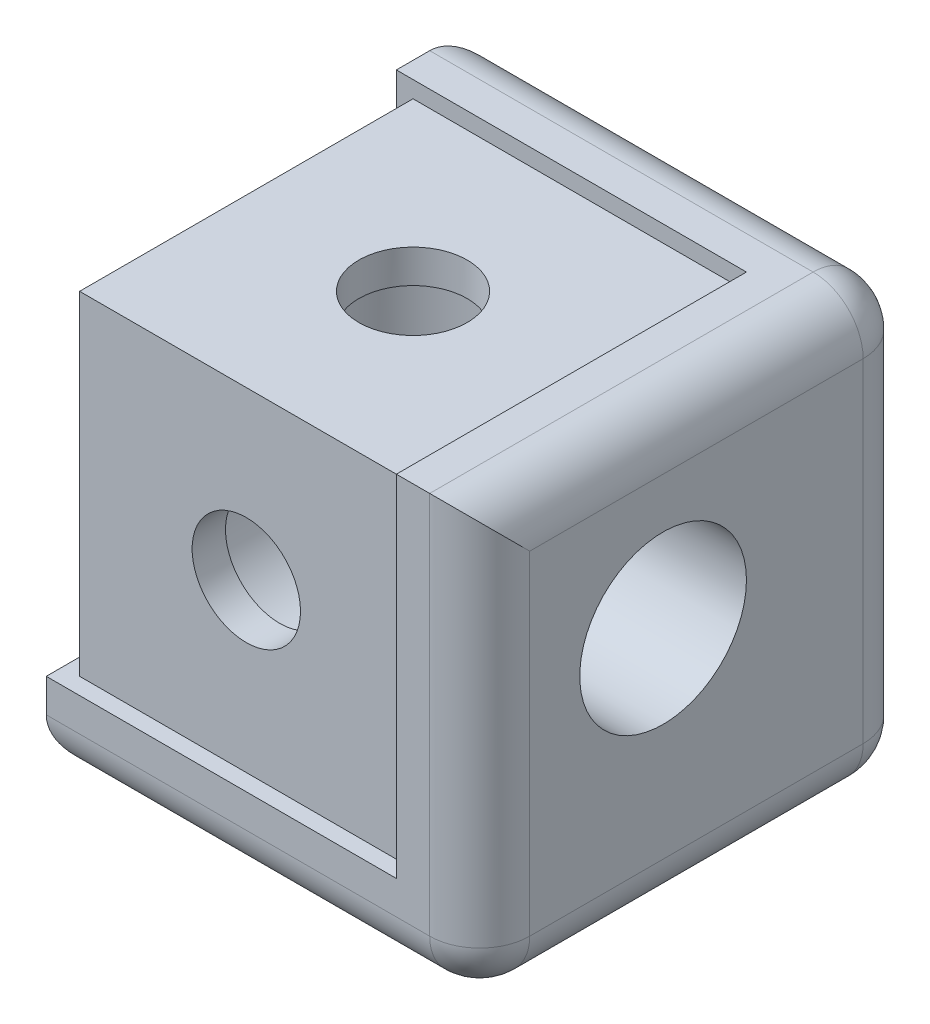
from build123d import *

# Parameters (mm, degrees)
SKETCH2_W           = 25
SKETCH2_H           = 25
BOSS_EXTRUDE1_DEPTH = 25
SKETCH3_R           = 3.25
CUT_EXTRUDE1_DEPTH  = 44.301270189
SKETCH4_R           = 3.25
CUT_EXTRUDE2_DEPTH  = 44.301270189
SKETCH5_R           = 3.25
CUT_EXTRUDE3_DEPTH  = 44.301270189
SKETCH6_R           = 5
CUT_EXTRUDE4_DEPTH  = 23
SKETCH7_R           = 5
CUT_EXTRUDE5_DEPTH  = 23
SKETCH12_R          = 5
CUT_EXTRUDE9_DEPTH  = 23
BOSS_EXTRUDE2_DEPTH = 1
BOSS_EXTRUDE3_DEPTH = 1
BOSS_EXTRUDE4_DEPTH = 1
FILLET2_R           = 3


with BuildPart() as part:
    # Sketch2 → Boss-Extrude1 (new body)
    with BuildSketch(Plane(origin=(0, 0, 0), x_dir=(1, 0, 0), z_dir=(0, 1, 0))):
        with Locations((12.5, 12.5)):
            Rectangle(SKETCH2_W, SKETCH2_H)
    extrude(amount=BOSS_EXTRUDE1_DEPTH)

    # Sketch3 → Cut-Extrude1 (cut, through all)
    with BuildSketch(Plane(origin=(0, 25, 0), x_dir=(1, 0, 0), z_dir=(0, 1, 0))):
        with Locations(Location((10, 10, 0), (0, 0, 270))):
            Circle(SKETCH3_R)
    extrude(amount=-CUT_EXTRUDE1_DEPTH, mode=Mode.SUBTRACT)

    # Sketch4 → Cut-Extrude2 (cut, through all)
    with BuildSketch(Plane.ZY):
        with Locations((-10, 15)):
            Circle(SKETCH4_R)
    extrude(amount=-CUT_EXTRUDE2_DEPTH, mode=Mode.SUBTRACT)

    # Sketch5 → Cut-Extrude3 (cut, through all)
    with BuildSketch(Plane.XY):
        with Locations((10, 15)):
            Circle(SKETCH5_R)
    extrude(amount=-CUT_EXTRUDE3_DEPTH, mode=Mode.SUBTRACT)

    # Sketch6 → Cut-Extrude4 (cut)
    with BuildSketch(Plane(origin=(0, 0, -25), x_dir=(-1, 0, 0), z_dir=(0, 0, -1))):
        with Locations((-10, 15)):
            Circle(SKETCH6_R)
    extrude(amount=-CUT_EXTRUDE4_DEPTH, mode=Mode.SUBTRACT)

    # Sketch7 → Cut-Extrude5 (cut)
    with BuildSketch(Plane(origin=(25, 0, 0), x_dir=(0, 0, -1), z_dir=(1, 0, 0))):
        with Locations((10, 15)):
            Circle(SKETCH7_R)
    extrude(amount=-CUT_EXTRUDE5_DEPTH, mode=Mode.SUBTRACT)

    # Sketch12 → Cut-Extrude9 (cut)
    with BuildSketch(Plane.XZ):
        with Locations(Location((10, -10, 0), (0, 0, 270))):
            Circle(SKETCH12_R)
    extrude(amount=-CUT_EXTRUDE9_DEPTH, mode=Mode.SUBTRACT)

    # Sketch19 → Boss-Extrude2 (add)
    with BuildSketch(Plane.XY):
        Polygon((20, 25), (20, 5), (0, 5), (0, 0), (25, 0), (25, 25), align=None)
    extrude(amount=BOSS_EXTRUDE2_DEPTH)

    # Sketch20 → Boss-Extrude3 (add)
    with BuildSketch(Plane(origin=(0, 25, 0), x_dir=(1, 0, 0), z_dir=(0, 1, 0))):
        Polygon((20, 0), (20, 20), (0, 20), (0, 25), (25, 25), (25, -1), (20, -1), align=None)
    extrude(amount=BOSS_EXTRUDE3_DEPTH)

    # Sketch21 → Boss-Extrude4 (add)
    with BuildSketch(Plane.ZY):
        Polygon((-20, 5), (0, 5), (1, 5), (1, 0), (-25, 0), (-25, 26), (-20, 26), (-20, 25), align=None)
    extrude(amount=BOSS_EXTRUDE4_DEPTH)

    # Fillet2
    fillet2_edges = [part.edges().sort_by_distance(p)[0] for p in [
        (12, 0, 1),
        (25, 13, 1),
        (25, 26, -12),
        (12, 26, -25),
        (-1, 13, -25),
        (-1, 0, -12),
        (12, 0, -25),
        (25, 0, -12),
        (25, 13, -25),
    ]]
    fillet(fillet2_edges, radius=FILLET2_R)


solid = part.part
